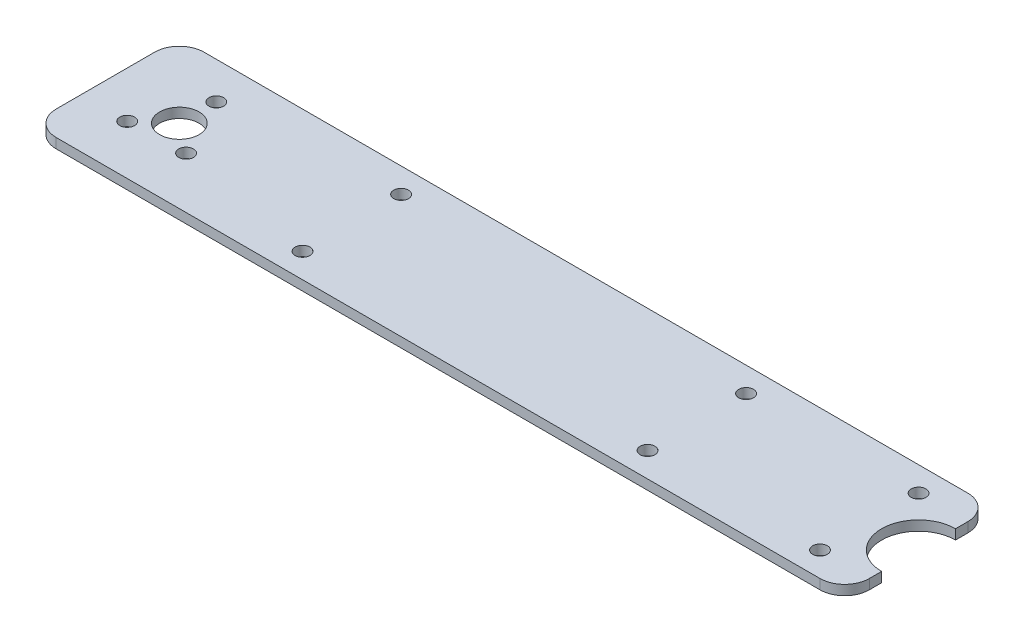
from build123d import *

# Parameters (mm, degrees)
SKETCH1_W           = 165
SKETCH1_H           = 30
BOSS_EXTRUDE1_DEPTH = 2
FILLET1_R           = 5
SKETCH3_R           = 4
SKETCH3_R_2         = 1.5
CUT_EXTRUDE1_DEPTH  = 2
SKETCH4_R           = 7.5
CUT_EXTRUDE2_DEPTH  = 10
SKETCH5_R           = 1.5
CUT_EXTRUDE3_DEPTH  = 10
SKETCH6_R           = 1.5
CUT_EXTRUDE4_DEPTH  = 84.876397157


with BuildPart() as part:
    # Sketch1 → Boss-Extrude1 (new body)
    with BuildSketch(Plane(origin=(0, 0, 0), x_dir=(1, 0, 0), z_dir=(0, 1, 0))):
        Rectangle(SKETCH1_W, SKETCH1_H)
    extrude(amount=BOSS_EXTRUDE1_DEPTH)

    # Fillet1
    fillet1_edges = [part.edges().sort_by_distance(p)[0] for p in [
        (82.5, 1, 15),
        (-82.5, 1, 15),
        (-82.5, 1, -15),
        (82.5, 1, -15),
    ]]
    fillet(fillet1_edges, radius=FILLET1_R)

    # Sketch3 → Cut-Extrude1 (cut)
    with BuildSketch(Plane(origin=(0, 2, 0), x_dir=(1, 0, 0), z_dir=(0, 1, 0))):
        with Locations(Location((-67.5, 0, 0), (0, 0, 270))):
            Circle(SKETCH3_R)
        with Locations(Location((-67.5, 7.5, 0), (0, 0, 270))):
            Circle(SKETCH3_R_2)
        with Locations(Location((-61.555061089, -4.572493996, 0), (0, 0, 270))):
            Circle(SKETCH3_R_2)
        with Locations(Location((-73.130988244, -4.953985406, 0), (0, 0, 270))):
            Circle(SKETCH3_R_2)
    extrude(amount=-CUT_EXTRUDE1_DEPTH, mode=Mode.SUBTRACT)

    # Sketch4 → Cut-Extrude2 (cut)
    with BuildSketch(Plane(origin=(0, 2, 0), x_dir=(1, 0, 0), z_dir=(0, 1, 0))):
        with Locations((82.5, 0)):
            Circle(SKETCH4_R)
    extrude(amount=-CUT_EXTRUDE2_DEPTH, mode=Mode.SUBTRACT)

    # Sketch5 → Cut-Extrude3 (cut)
    with BuildSketch(Plane(origin=(0, 2, 0), x_dir=(1, 0, 0), z_dir=(0, 1, 0))):
        with Locations(Location((-32.5, 10, 0), (0, 0, 270))):
            Circle(SKETCH5_R)
        with Locations(Location((37.5, 10, 0), (0, 0, 270))):
            Circle(SKETCH5_R)
        with Locations(Location((-32.5, -10, 0), (0, 0, 270))):
            Circle(SKETCH5_R)
        with Locations(Location((37.5, -10, 0), (0, 0, 270))):
            Circle(SKETCH5_R)
    extrude(amount=-CUT_EXTRUDE3_DEPTH, mode=Mode.SUBTRACT)

    # Sketch6 → Cut-Extrude4 (cut, through all)
    with BuildSketch(Plane(origin=(0, 2, 0), x_dir=(1, 0, 0), z_dir=(0, 1, 0))):
        with Locations(Location((72.5, 10, 0), (0, 0, 270))):
            Circle(SKETCH6_R)
        with Locations(Location((72.5, -10, 0), (0, 0, 270))):
            Circle(SKETCH6_R)
    extrude(amount=-CUT_EXTRUDE4_DEPTH, mode=Mode.SUBTRACT)


solid = part.part
